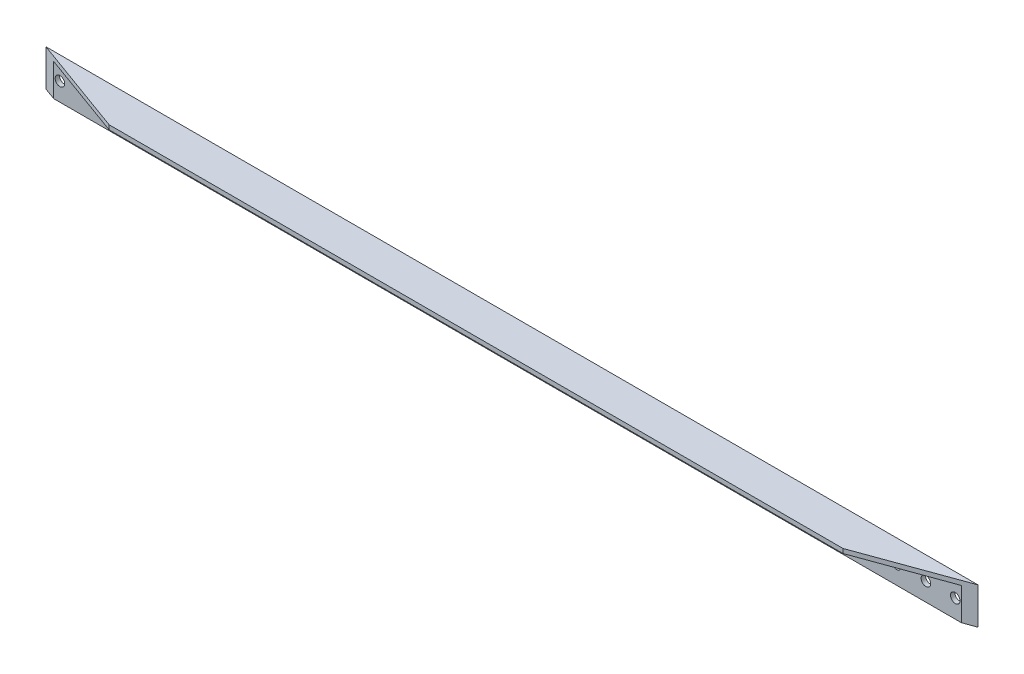
from build123d import *

# Parameters (mm, degrees)
SKETCH_1_W          = 2540
SKETCH_1_H          = 100
SKETCH_1_R          = 13
EXTRUDE_520_DEPTH   = 12
SKETCH_2_W          = 2540
SKETCH_2_H          = 12
EXTRUDE_1_DEPTH     = 86
CUT_EXTRUDE_1_DEPTH = 1278.694799238


with BuildPart() as part:
    # 草图1 → Extrude 520 (new body)
    with BuildSketch(Plane.XY):
        Rectangle(SKETCH_1_W, SKETCH_1_H)
        with Locations((1220, 0)):
            Circle(SKETCH_1_R, mode=Mode.SUBTRACT)
        with Locations((1140, 0)):
            Circle(SKETCH_1_R, mode=Mode.SUBTRACT)
        with Locations((1060, 0)):
            Circle(SKETCH_1_R, mode=Mode.SUBTRACT)
        with Locations((980, 0)):
            Circle(SKETCH_1_R, mode=Mode.SUBTRACT)
        with Locations((580, 0)):
            Circle(SKETCH_1_R, mode=Mode.SUBTRACT)
        with Locations((460, 0)):
            Circle(SKETCH_1_R, mode=Mode.SUBTRACT)
        with Locations((380, 0)):
            Circle(SKETCH_1_R, mode=Mode.SUBTRACT)
        with Locations((300, 0)):
            Circle(SKETCH_1_R, mode=Mode.SUBTRACT)
        with Locations((180, 0)):
            Circle(SKETCH_1_R, mode=Mode.SUBTRACT)
        with Locations(Location((-180, 0, 0), (0, 0, 180))):
            Circle(SKETCH_1_R, mode=Mode.SUBTRACT)
        with Locations(Location((-300, 0, 0), (0, 0, 180))):
            Circle(SKETCH_1_R, mode=Mode.SUBTRACT)
        with Locations(Location((-380, 0, 0), (0, 0, 180))):
            Circle(SKETCH_1_R, mode=Mode.SUBTRACT)
        with Locations(Location((-460, 0, 0), (0, 0, 180))):
            Circle(SKETCH_1_R, mode=Mode.SUBTRACT)
        with Locations(Location((-580, 0, 0), (0, 0, 180))):
            Circle(SKETCH_1_R, mode=Mode.SUBTRACT)
        with Locations(Location((-980, 0, 0), (0, 0, 180))):
            Circle(SKETCH_1_R, mode=Mode.SUBTRACT)
        with Locations(Location((-1060, 0, 0), (0, 0, 180))):
            Circle(SKETCH_1_R, mode=Mode.SUBTRACT)
        with Locations(Location((-1140, 0, 0), (0, 0, 180))):
            Circle(SKETCH_1_R, mode=Mode.SUBTRACT)
        with Locations(Location((-1220, 0, 0), (0, 0, 180))):
            Circle(SKETCH_1_R, mode=Mode.SUBTRACT)
    extrude(amount=EXTRUDE_520_DEPTH)

    # 草图2 → 凸台-拉伸1 (add)
    with BuildSketch(Plane.XY.offset(12)):
        with Locations((0, 44)):
            Rectangle(SKETCH_2_W, SKETCH_2_H)
    extrude(amount=EXTRUDE_1_DEPTH)

    # 草图4 → 切除-拉伸1 (cut, through all)
    with BuildSketch(Plane(origin=(0, 50, 0), x_dir=(-1, 0, 0), z_dir=(0, 1, 0))):
        Polygon((-1270, 0), (-1270, 98), (-1000, 98), align=None)
        Polygon((1270, 0), (1000, 98), (1270, 98), align=None)
    extrude(amount=-CUT_EXTRUDE_1_DEPTH, mode=Mode.SUBTRACT)


solid = part.part
